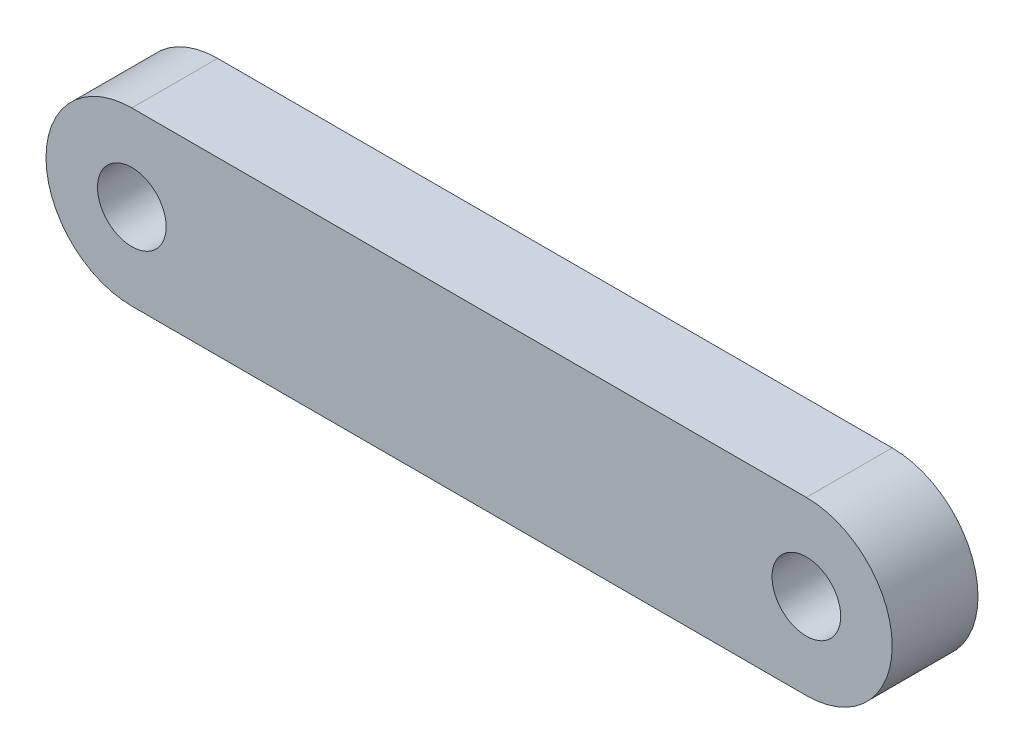
from build123d import *

# Parameters (mm, degrees)
SKETCH_2_R      = 2
EXTRUDE_1_DEPTH = 2.5


with BuildPart() as part:
    # 草圖2 → 填料-伸長1 (new, symmetric)
    with BuildSketch(Plane.XY):
        with BuildLine():
            Line((-19.65, 5), (19.65, 5))
            ThreePointArc((19.65, 5), (24.65, 0), (19.65, -5))
            Line((19.65, -5), (-19.65, -5))
            ThreePointArc((-19.65, -5), (-24.65, 0), (-19.65, 5))
        make_face()
        with Locations((19.65, 0)):
            Circle(SKETCH_2_R, mode=Mode.SUBTRACT)
        with Locations((-19.65, 0)):
            Circle(SKETCH_2_R, mode=Mode.SUBTRACT)
    extrude(amount=EXTRUDE_1_DEPTH, both=True)


solid = part.part
